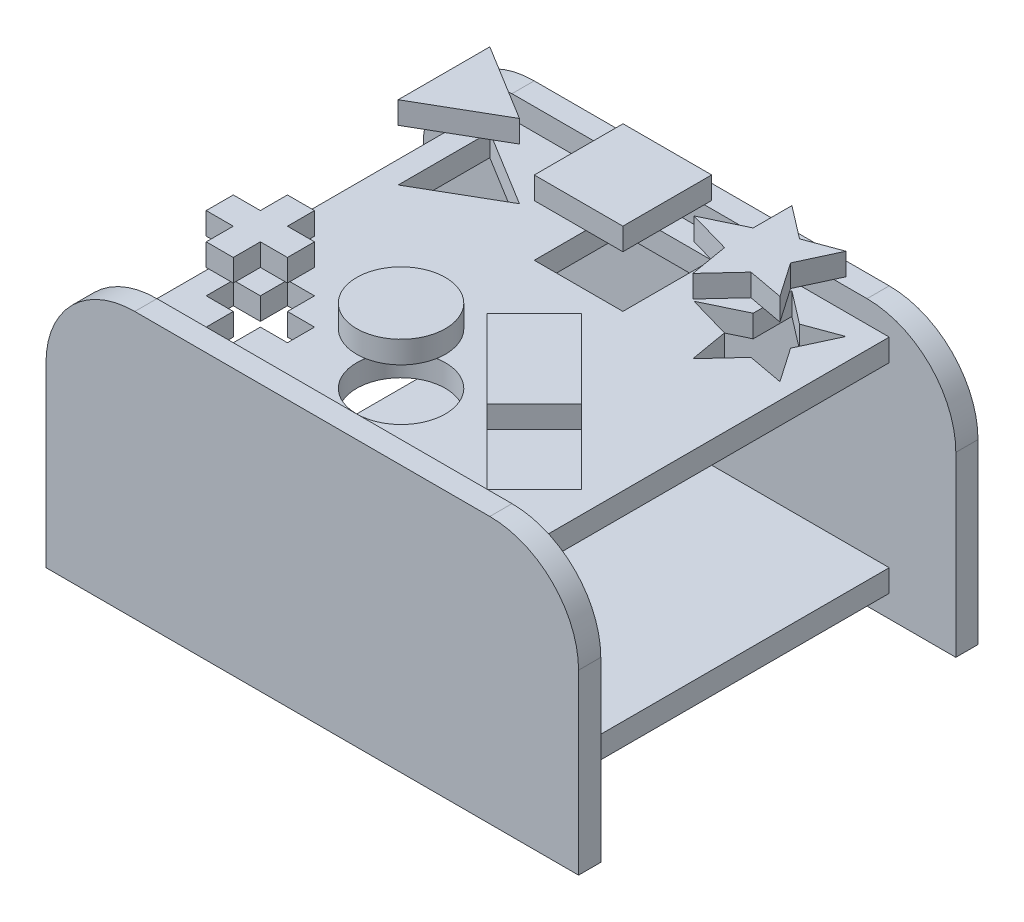
from build123d import *

# Parameters (mm, degrees)
SKETCH1_W             = 304.8
SKETCH1_H             = 152.4
BOSS_EXTRUDE1_DEPTH   = 12.7
FILLET3_R             = 50.8
SKETCH2_W             = 228.6
SKETCH2_H             = 12.7
BOSS_EXTRUDE2_DEPTH   = 203.2
SKETCH3_W             = 304.8
SKETCH3_H             = 152.4
BOSS_EXTRUDE3_DEPTH   = 12.7
FILLET4_R             = 50.8
SKETCH5_W             = 228.6
SKETCH5_H             = 12.7
BOSS_EXTRUDE5_DEPTH   = 203.2
SKETCH6_R             = 25.4
CUT_EXTRUDE1_DEPTH    = 50.8
CUT_EXTRUDE2_DEPTH    = 50.8
CUT_EXTRUDE3_DEPTH    = 50.8
CUT_EXTRUDE5_DEPTH    = 50.8
CUT_EXTRUDE7_DEPTH    = 50.8
BOSS_EXTRUDE9_START   = 12.7
SKETCH17_R            = 25.4
BOSS_EXTRUDE9_DEPTH   = 12.7
BOSS_EXTRUDE9_2_DEPTH = 12.7
BOSS_EXTRUDE9_3_DEPTH = 12.7
BOSS_EXTRUDE9_4_DEPTH = 12.7
SKETCH17_W            = 50.70474023
SKETCH17_H            = 50.8
BOSS_EXTRUDE9_5_DEPTH = 12.7
BOSS_EXTRUDE9_6_DEPTH = 12.7


with BuildPart() as part:
    # Sketch1 → Boss-Extrude1 (new body)
    with BuildSketch(Plane.XY):
        with Locations((152.4, 76.2)):
            Rectangle(SKETCH1_W, SKETCH1_H)
    extrude(amount=BOSS_EXTRUDE1_DEPTH)

    # Fillet3
    fillet3_edges = [part.edges().sort_by_distance(p)[0] for p in [
        (0, 152.4, 6.35),
        (304.8, 152.4, 6.35),
    ]]
    fillet(fillet3_edges, radius=FILLET3_R)

    # Sketch2 → Boss-Extrude2 (add)
    with BuildSketch(Plane.XY.offset(12.7)):
        with Locations((152.4, 133.35)):
            Rectangle(SKETCH2_W, SKETCH2_H)
    extrude(amount=BOSS_EXTRUDE2_DEPTH)

    # Sketch3 → Boss-Extrude3 (add)
    with BuildSketch(Plane.XY.offset(215.9)):
        with Locations((152.4, 76.2)):
            Rectangle(SKETCH3_W, SKETCH3_H)
    extrude(amount=BOSS_EXTRUDE3_DEPTH)

    # Fillet4
    fillet4_edges = [part.edges().sort_by_distance(p)[0] for p in [
        (0, 152.4, 222.25),
        (304.8, 152.4, 222.25),
    ]]
    fillet(fillet4_edges, radius=FILLET4_R)

    # Sketch5 → Boss-Extrude5 (add)
    with BuildSketch(Plane.XY.offset(12.7)):
        with Locations((152.4, 19.05)):
            Rectangle(SKETCH5_W, SKETCH5_H)
    extrude(amount=BOSS_EXTRUDE5_DEPTH)

    # Sketch6 → Cut-Extrude1 (cut)
    with BuildSketch(Plane(origin=(0, 139.7, 0), x_dir=(1, 0, 0), z_dir=(0, 1, 0))):
        with Locations(Location((152.4, -177.8, 0), (0, 0, 270))):
            Circle(SKETCH6_R)
        Polygon((127.047629885, -25.4), (127.047629885, -76.2), (152.4, -76.2), (177.752370115, -76.2), (177.752370115, -50.8), (177.752370115, -25.4), align=None)
    extrude(amount=-CUT_EXTRUDE1_DEPTH, mode=Mode.SUBTRACT)

    # Sketch7 → Cut-Extrude2 (cut)
    with BuildSketch(Plane(origin=(0, 139.7, 0), x_dir=(1, 0, 0), z_dir=(0, 1, 0))):
        Polygon((50.8, -25.4), (50.8, -77.824929978), (94.794090512, -52.424929978), align=None)
    extrude(amount=-CUT_EXTRUDE2_DEPTH, mode=Mode.SUBTRACT)

    # Sketch8 → Cut-Extrude3 (cut)
    with BuildSketch(Plane(origin=(0, 139.7, 0), x_dir=(1, 0, 0), z_dir=(0, 1, 0))):
        Polygon((66.294, -156.718), (66.294, -172.212), (50.8, -172.212), (50.8, -187.706), (66.294, -187.706), (66.294, -203.2), (81.788, -203.2), (81.788, -187.706), (97.282, -187.706), (97.282, -172.212), (81.788, -172.212), (81.788, -156.718), align=None)
    extrude(amount=-CUT_EXTRUDE3_DEPTH, mode=Mode.SUBTRACT)

    # Sketch10 → Cut-Extrude5 (cut)
    with BuildSketch(Plane(origin=(0, 139.7, 0), x_dir=(1, 0, 0), z_dir=(0, 1, 0))):
        Polygon((254, -176.259231637), (227.059231637, -203.2), (182.157951031, -158.298719395), (209.098719395, -131.357951031), align=None)
    extrude(amount=-CUT_EXTRUDE5_DEPTH, mode=Mode.SUBTRACT)

    # Sketch11 → Cut-Extrude7 (cut)
    with BuildSketch(Plane(origin=(0, 139.7, 0), x_dir=(1, 0, 0), z_dir=(0, 1, 0))):
        Polygon((193.03591652, -50.8), (243.964438371, -46.447008303), (257.528748086, -66.08101348), (237.196986142, -62.324961711), (221.229311995, -79.589137786), (217.467804029, -57.745708944), align=None)
        Polygon((254, -24.795861449), (243.964438371, -46.447008303), (193.03591652, -50.8), (215.934691813, -39.808817622), (215.934691813, -17.643883024), (234.600575441, -31.947839874), align=None)
    extrude(amount=-CUT_EXTRUDE7_DEPTH, mode=Mode.SUBTRACT)


with BuildPart() as body_2:
    # Sketch17 → Boss-Extrude9 (new body)
    with BuildSketch(Plane(origin=(0, 169.265167748, 0), x_dir=(1, 0, 0), z_dir=(0, 1, 0)).offset(BOSS_EXTRUDE9_START)):
        with Locations(Location((152.4, -177.8, 0), (0, 0, 270))):
            Circle(SKETCH17_R)
    extrude(amount=-BOSS_EXTRUDE9_DEPTH)


with BuildPart() as body_3:
    # Sketch17 → Boss-Extrude9 2 (new body)
    with BuildSketch(Plane(origin=(0, 169.265167748, 0), x_dir=(1, 0, 0), z_dir=(0, 1, 0)).offset(BOSS_EXTRUDE9_START)):
        Polygon((50.8, -25.4), (50.8, -77.824929978), (94.794090512, -52.424929978), align=None)
    extrude(amount=-BOSS_EXTRUDE9_2_DEPTH)


with BuildPart() as body_4:
    # Sketch17 → Boss-Extrude9 3 (new body)
    with BuildSketch(Plane(origin=(0, 169.265167748, 0), x_dir=(1, 0, 0), z_dir=(0, 1, 0)).offset(BOSS_EXTRUDE9_START)):
        Polygon((66.294, -156.718), (81.788, -156.718), (81.788, -172.212), (97.282, -172.212), (97.282, -187.706), (81.788, -187.706), (81.788, -203.2), (66.294, -203.2), (66.294, -187.706), (50.8, -187.706), (50.8, -172.212), (66.294, -172.212), align=None)
    extrude(amount=-BOSS_EXTRUDE9_3_DEPTH)


with BuildPart() as body_5:
    # Sketch17 → Boss-Extrude9 4 (new body)
    with BuildSketch(Plane(origin=(0, 169.265167748, 0), x_dir=(1, 0, 0), z_dir=(0, 1, 0)).offset(BOSS_EXTRUDE9_START)):
        Polygon((182.157951031, -158.298719395), (209.098719395, -131.357951031), (254, -176.259231637), (227.059231637, -203.2), align=None)
    extrude(amount=-BOSS_EXTRUDE9_4_DEPTH)


with BuildPart() as body_6:
    # Sketch17 → Boss-Extrude9 5 (new body)
    with BuildSketch(Plane(origin=(0, 169.265167748, 0), x_dir=(1, 0, 0), z_dir=(0, 1, 0)).offset(BOSS_EXTRUDE9_START)):
        with Locations((152.4, -50.8)):
            Rectangle(SKETCH17_W, SKETCH17_H)
    extrude(amount=-BOSS_EXTRUDE9_5_DEPTH)


with BuildPart() as body_7:
    # Sketch17 → Boss-Extrude9 6 (new body)
    with BuildSketch(Plane(origin=(0, 169.265167748, 0), x_dir=(1, 0, 0), z_dir=(0, 1, 0)).offset(BOSS_EXTRUDE9_START)):
        Polygon((193.03591652, -50.8), (215.934691813, -39.808817622), (215.934691813, -17.643883024), (234.600575441, -31.947839874), (254, -24.795861449), (243.964438371, -46.447008303), (257.528748086, -66.08101348), (237.196986142, -62.324961711), (221.229311995, -79.589137786), (217.467804029, -57.745708944), align=None)
    extrude(amount=-BOSS_EXTRUDE9_6_DEPTH)


solid = Compound([part.part, body_2.part, body_3.part, body_4.part, body_5.part, body_6.part, body_7.part])
